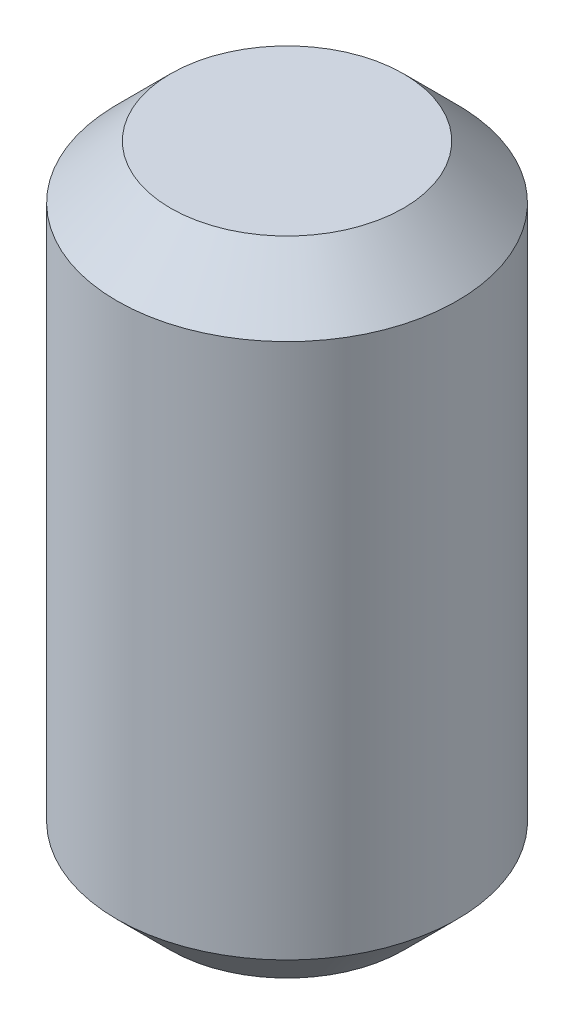
from build123d import *

# Parameters (mm, degrees)
SKETCH_1_R      = 1.5875
EXTRUDE_1_DEPTH = 6
CHAMFER_1_SIZE  = 0.5


with BuildPart() as part:
    # Эскиз1 → Бобышка-Вытянуть1 (new body)
    with BuildSketch(Plane(origin=(0, 0, 0), x_dir=(1, 0, 0), z_dir=(0, 1, 0))):
        with Locations(Location((0, 0, 0), (0, 0, 270))):
            Circle(SKETCH_1_R)
    extrude(amount=EXTRUDE_1_DEPTH)

    # Фаска1
    chamfer_1_edges = [part.edges().sort_by_distance(p)[0] for p in [
        (0, 0, -1.5875),
        (0, 6, -1.5875),
    ]]
    chamfer(chamfer_1_edges, length=CHAMFER_1_SIZE)


solid = part.part
